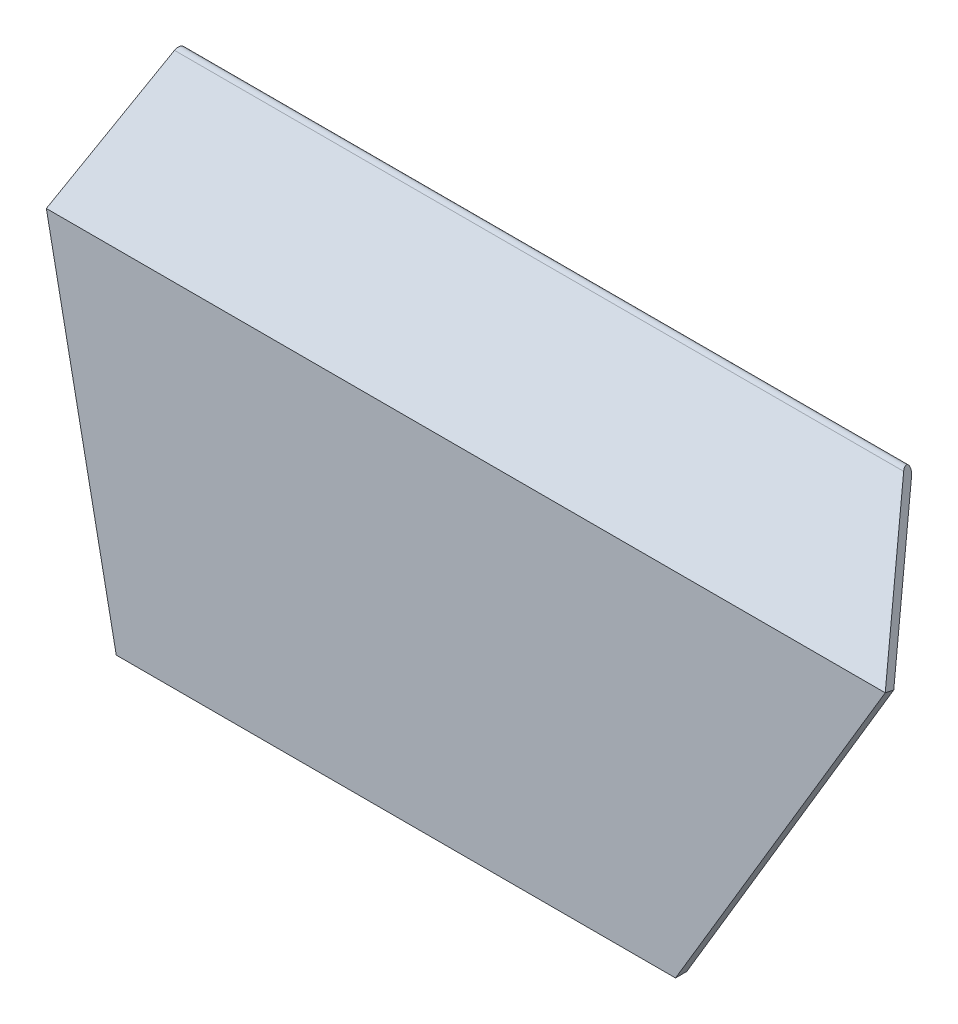
from build123d import *

# Parameters (mm, degrees)
BOSS_EXTRUDE1_DEPTH = 600
CUT_EXTRUDE2_DEPTH  = 16
CUT_EXTRUDE3_REACH  = 826.099
SKETCH5_R           = 16
CUT_EXTRUDE4_DEPTH  = 4


with BuildPart() as part:
    # Sketch1 → Boss-Extrude1 (new, symmetric)
    with BuildSketch(Plane(origin=(0, 0, 0), x_dir=(0, 0, -1), z_dir=(1, 0, 0))):
        with BuildLine():
            Line((8, 0), (8, 496.686291501))
            Line((8, 496.686291501), (147.078210487, 635.764501988))
            ThreePointArc((147.078210487, 635.764501988), (147.078210487, 647.078210487), (135.764501988, 647.078210487))
            Line((135.764501988, 647.078210487), (-8, 503.313708499))
            Line((-8, 503.313708499), (-8, 0))
            Line((-8, 0), (8, 0))
        make_face()
    extrude(amount=BOSS_EXTRUDE1_DEPTH, both=True)

    # Sketch2 → Cut-Extrude2 (cut)
    with BuildSketch(Plane.XY.offset(8)):
        Polygon((-600, 503.313708499), (-500, 0), (-600, 0), align=None)
        Polygon((600, 503.313708499), (300, 0), (600, 0), align=None)
    extrude(amount=-CUT_EXTRUDE2_DEPTH, mode=Mode.SUBTRACT)

    # Cut-Extrude3: up to this face of the body (flat: up to its plane)
    cut_extrude3_end = Plane(part.part.faces().sort_by_distance((0, 566.225396744, -77.539105243))[0])
    # Sketch3 → Cut-Extrude3 (cut, up to the picked face)
    with BuildSketch(Plane(origin=(0, 255.656854249, 255.656854249), x_dir=(1, 0, 0), z_dir=(0, 0.7071067811865477, 0.7071067811865475)), mode=Mode.PRIVATE) as cut_extrude3_sk1:
        Polygon((600, 350.239682094), (477.997973515, 561.553390593), (600, 561.553390593), align=None)
    cut_extrude3_tool1 = split(extrude(cut_extrude3_sk1.sketch, amount=-CUT_EXTRUDE3_REACH, mode=Mode.PRIVATE), bisect_by=cut_extrude3_end, keep=Keep.BOTH, mode=Mode.PRIVATE)
    # Sketch3 → Cut-Extrude3 (cut, up to the picked face)
    with BuildSketch(Plane(origin=(0, 255.656854249, 255.656854249), x_dir=(1, 0, 0), z_dir=(0, 0.7071067811865477, 0.7071067811865475)), mode=Mode.PRIVATE) as cut_extrude3_sk2:
        Polygon((-600, 350.239682094), (-558.924776017, 561.553390593), (-600, 561.553390593), align=None)
    cut_extrude3_tool2 = split(extrude(cut_extrude3_sk2.sketch, amount=-CUT_EXTRUDE3_REACH, mode=Mode.PRIVATE), bisect_by=cut_extrude3_end, keep=Keep.BOTH, mode=Mode.PRIVATE)
    add(cut_extrude3_tool1.solids().sort_by(Axis((559.332658, 602.927946, -91.614237), (0, -0.7071067811865477, -0.7071067811865475)))[0], mode=Mode.SUBTRACT)
    add(cut_extrude3_tool2.solids().sort_by(Axis((-586.308259, 602.927946, -91.614237), (0, -0.7071067811865477, -0.7071067811865475)))[0], mode=Mode.SUBTRACT)

    # Sketch5 → Cut-Extrude4 (cut)
    with BuildSketch(Plane(origin=(0, 0, -8), x_dir=(-1, 0, 0), z_dir=(0, 0, -1))):
        with Locations((430.63716206, 333.578975831)):
            Circle(SKETCH5_R)
        with Locations((176.078720833, 333.578975831)):
            Circle(SKETCH5_R)
        with Locations((176.078720833, 79.020534604)):
            Circle(SKETCH5_R)
        with Locations((430.63716206, 79.020534604)):
            Circle(SKETCH5_R)
    extrude(amount=-CUT_EXTRUDE4_DEPTH, mode=Mode.SUBTRACT)


solid = part.part
